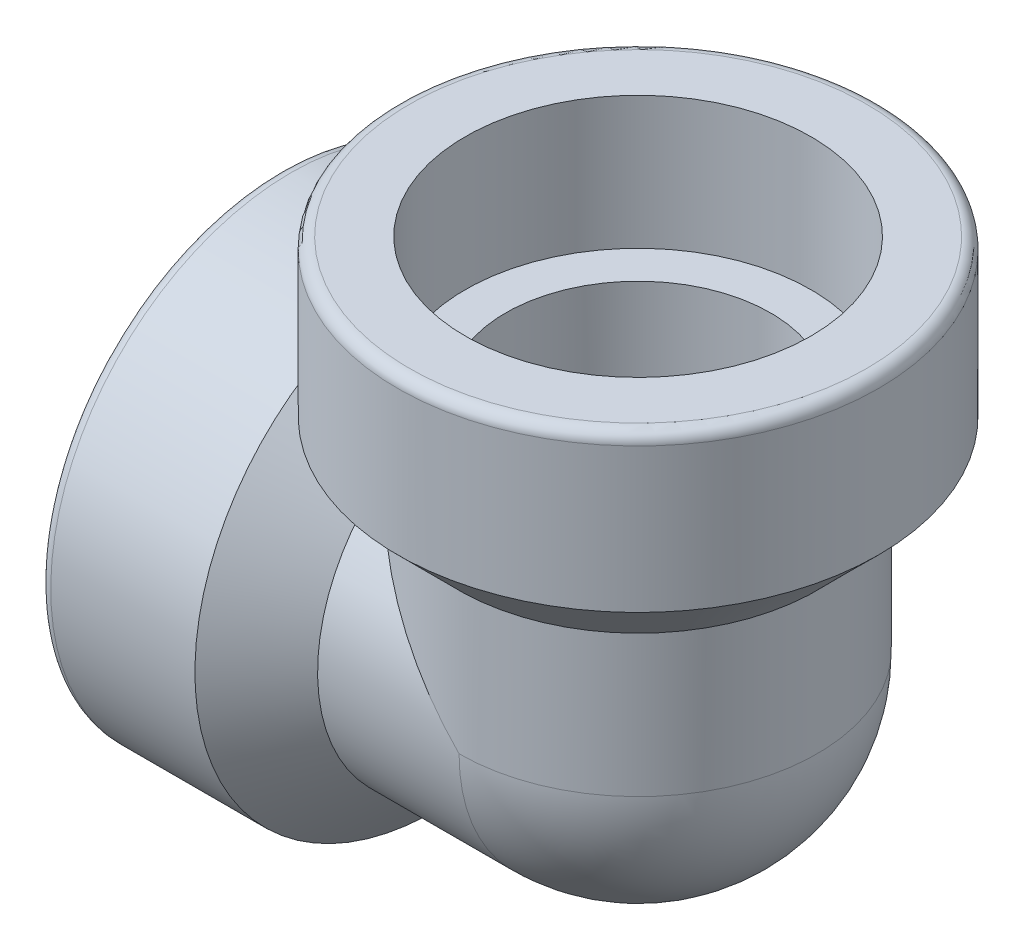
from build123d import *

# Parameters (mm, degrees)
CIRPATTERN2_COUNT  = 2
CIRPATTERN2_ANGLE  = 90
SKETCH4_R          = 12.954
CUT_EXTRUDE1_DEPTH = 55.857091
SKETCH5_R          = 12.954
CUT_EXTRUDE2_DEPTH = 55.857091
REVOLVE2_ANGLE     = 90


with BuildPart() as part:
    # Sketch2 → Revolve1 (revolve)
    with BuildSketch(Plane.XY, mode=Mode.PRIVATE) as revolve1_sk:
        with BuildLine():
            Line((-35.052, -16.891), (-22.098, -16.891))
            Line((-22.098, -16.891), (-22.098, -12.954))
            Line((-22.098, -12.954), (0, -12.954))
            Line((0, -12.954), (0, -17.5006))
            Line((0, -17.5006), (-13.8303, -17.5006))
            Line((-13.8303, -17.5006), (-19.8247, -23.495))
            Line((-19.8247, -23.495), (-33.91535, -23.495))
            ThreePointArc((-33.91535, -23.495), (-34.719082923, -23.162082923), (-35.052, -22.35835))
            Line((-35.052, -22.35835), (-35.052, -16.891))
        make_face()
    revolve(revolve1_sk.sketch.rotate(Axis((0, 0, 0), (-1, 0, 0)), 180), axis=Axis((0, 0, 0), (-1, 0, 0)))


with BuildPart() as cirpattern2_1:
    # CirPattern2: pattern copy
    add(part.part.rotate(Axis((0, 0, -23.495), (0, 0, -1)), 1 * CIRPATTERN2_ANGLE / (CIRPATTERN2_COUNT - 1)))

    # Sketch4 → Cut-Extrude1 (cut, through all)
    with BuildSketch(Plane(origin=(0, 0, 0), x_dir=(0, 0, -1), z_dir=(1, 0, 0))):
        with Locations(Location((0, 0, 0), (0, 0, 90))):
            Circle(SKETCH4_R)
    extrude(amount=-CUT_EXTRUDE1_DEPTH, mode=Mode.SUBTRACT)


with BuildPart() as part_1:
    add(part.part)

    # Sketch5 → Cut-Extrude2 (cut, through all)
    with BuildSketch(Plane.XZ):
        Circle(SKETCH5_R)
    extrude(amount=-CUT_EXTRUDE2_DEPTH, mode=Mode.SUBTRACT)

    # Combine1: union CirPattern2_1
    add(cirpattern2_1.part)

    # Sketch6 → Revolve2 (revolve)
    with BuildSketch(Plane(origin=(0, 0, 0), x_dir=(0, 0, -1), z_dir=(1, 0, 0))):
        with BuildLine():
            Line((-17.5006, 0), (-12.954, 0))
            ThreePointArc((-12.954, 0), (0, -12.954), (12.954, 0))
            Line((12.954, 0), (17.5006, 0))
            ThreePointArc((17.5006, 0), (0, -17.5006), (-17.5006, 0))
        make_face()
    revolve(axis=Axis((0, 0, 12.954), (0, 0, 1)), revolution_arc=REVOLVE2_ANGLE)


solid = part_1.part
